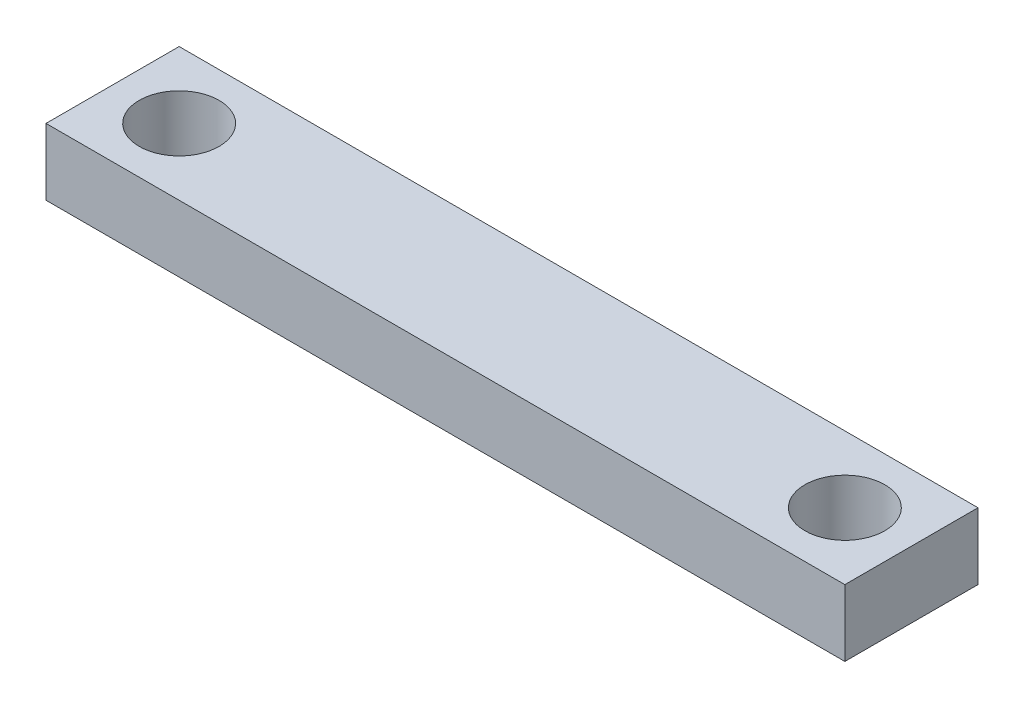
from build123d import *

# Parameters (mm, degrees)
SKETCH1_W           = 60
SKETCH1_H           = 10
SKETCH1_R           = 3
BOSS_EXTRUDE1_DEPTH = 2.5


with BuildPart() as part:
    # Sketch1 → Boss-Extrude1 (new, symmetric)
    with BuildSketch(Plane(origin=(0, 0, 0), x_dir=(1, 0, 0), z_dir=(0, 1, 0))):
        Rectangle(SKETCH1_W, SKETCH1_H)
        with Locations(Location((-25, 0, 0), (0, 0, 270))):
            Circle(SKETCH1_R, mode=Mode.SUBTRACT)
        with Locations(Location((25, 0, 0), (0, 0, 270))):
            Circle(SKETCH1_R, mode=Mode.SUBTRACT)
    extrude(amount=BOSS_EXTRUDE1_DEPTH, both=True)


solid = part.part
